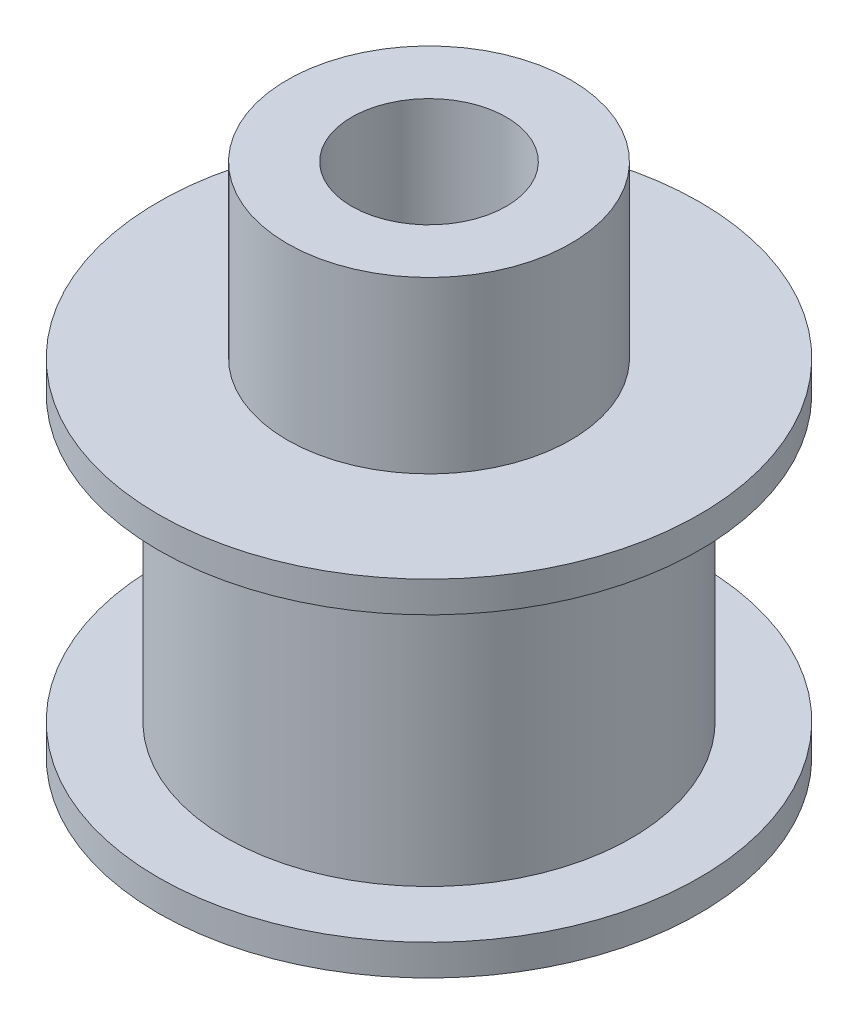
from build123d import *

# Parameters (mm, degrees)
SKETCH1_R           = 10.5
BOSS_EXTRUDE1_DEPTH = 1.2
SKETCH2_R           = 7.85
BOSS_EXTRUDE2_DEPTH = 11
SKETCH3_R           = 10.5
BOSS_EXTRUDE3_DEPTH = 1.2
SKETCH4_R           = 5.5
BOSS_EXTRUDE4_DEPTH = 6.6
SKETCH5_R           = 3
CUT_EXTRUDE1_DEPTH  = 25.909837414


with BuildPart() as part:
    # Sketch1 → Boss-Extrude1 (new body)
    with BuildSketch(Plane(origin=(0, 0, 0), x_dir=(1, 0, 0), z_dir=(0, 1, 0))):
        with Locations(Location((0, 0, 0), (0, 0, 270))):
            Circle(SKETCH1_R)
    extrude(amount=BOSS_EXTRUDE1_DEPTH)

    # Sketch2 → Boss-Extrude2 (add)
    with BuildSketch(Plane(origin=(0, 1.2, 0), x_dir=(1, 0, 0), z_dir=(0, 1, 0))):
        with Locations(Location((0, 0, 0), (0, 0, 270))):
            Circle(SKETCH2_R)
    extrude(amount=BOSS_EXTRUDE2_DEPTH)

    # Sketch3 → Boss-Extrude3 (add)
    with BuildSketch(Plane(origin=(0, 12.2, 0), x_dir=(1, 0, 0), z_dir=(0, 1, 0))):
        with Locations(Location((0, 0, 0), (0, 0, 270))):
            Circle(SKETCH3_R)
    extrude(amount=BOSS_EXTRUDE3_DEPTH)

    # Sketch4 → Boss-Extrude4 (add)
    with BuildSketch(Plane(origin=(0, 13.4, 0), x_dir=(1, 0, 0), z_dir=(0, 1, 0))):
        with Locations(Location((0, 0, 0), (0, 0, 270))):
            Circle(SKETCH4_R)
    extrude(amount=BOSS_EXTRUDE4_DEPTH)

    # Sketch5 → Cut-Extrude1 (cut, through all)
    with BuildSketch(Plane(origin=(0, 20, 0), x_dir=(1, 0, 0), z_dir=(0, 1, 0))):
        with Locations(Location((0, 0, 0), (0, 0, 270))):
            Circle(SKETCH5_R)
    extrude(amount=-CUT_EXTRUDE1_DEPTH, mode=Mode.SUBTRACT)


solid = part.part
